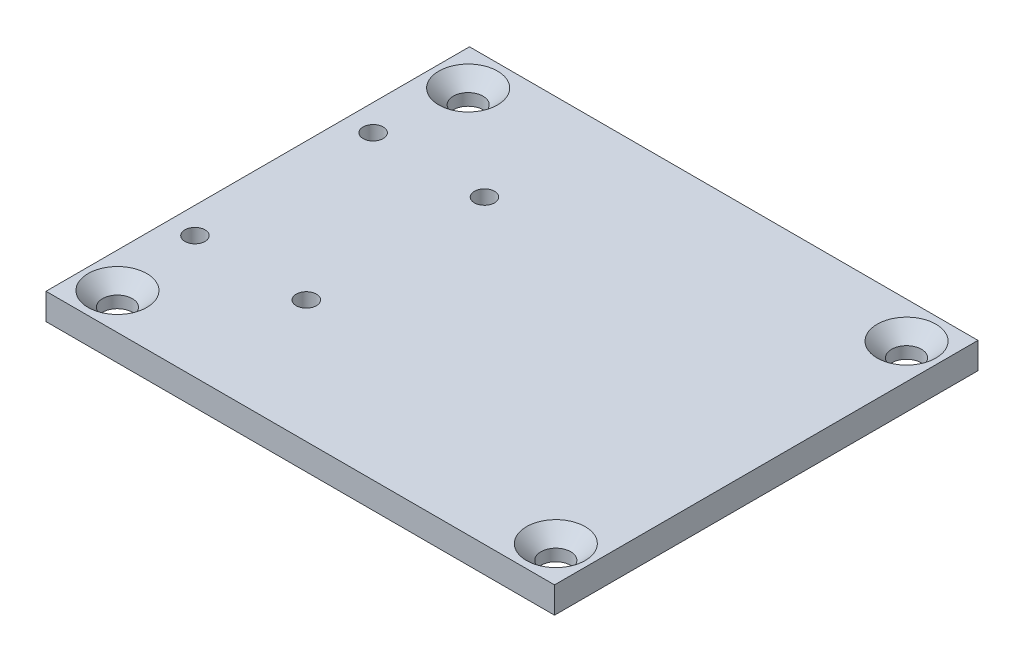
from build123d import *

# Parameters (mm, degrees)
SKETCH1_W                                      = 58
SKETCH1_H                                      = 48.3
BOSS_EXTRUDE1_DEPTH                            = 3
CSK_FOR_M3_FLAT_HEAD_MACHINE_SCREW1_AT_2_COUNT = 2
CSK_FOR_M3_FLAT_HEAD_MACHINE_SCREW1_AT_2_PITCH = 40
CSK_FOR_M3_FLAT_HEAD_MACHINE_SCREW1_AT_3_COUNT = 2
CSK_FOR_M3_FLAT_HEAD_MACHINE_SCREW1_AT_3_PITCH = 50
CSK_FOR_M3_FLAT_HEAD_MACHINE_SCREW1_AT_4_COUNT = 2
CSK_FOR_M3_FLAT_HEAD_MACHINE_SCREW1_AT_4_PITCH = 64.031242374
SKETCH6_R                                      = 1.15
CUT_EXTRUDE1_DEPTH                             = 10


with BuildPart() as part:
    # Sketch1 → Boss-Extrude1 (new body)
    with BuildSketch(Plane(origin=(0, 0, 0), x_dir=(1, 0, 0), z_dir=(0, 1, 0))):
        Rectangle(SKETCH1_W, SKETCH1_H)
    extrude(amount=BOSS_EXTRUDE1_DEPTH)

    # Sketch3 → CSK for M3 Flat Head Machine Screw1 (revolve, cut)
    with BuildSketch(Plane(origin=(25, 3, 20), x_dir=(0, 0, 1), z_dir=(1, 0, 0))):
        Polygon((0, 0), (0, 3), (1.7, 3), (1.7, 1.65), (3.35, 0), align=None)
    csk_for_m3_flat_head_machine_screw1 = revolve(axis=Axis((25, 9.35, 20), (0, -1, 0)), mode=Mode.SUBTRACT)

    # CSK for M3 Flat Head Machine Screw1 at 2: CSK for M3 Flat Head Machine Screw1 ×2
    with Locations(*[(0, 0, -i * CSK_FOR_M3_FLAT_HEAD_MACHINE_SCREW1_AT_2_PITCH) for i in range(1, CSK_FOR_M3_FLAT_HEAD_MACHINE_SCREW1_AT_2_COUNT)]):
        add(csk_for_m3_flat_head_machine_screw1, mode=Mode.SUBTRACT)

    # CSK for M3 Flat Head Machine Screw1 at 3: CSK for M3 Flat Head Machine Screw1 ×2
    with Locations(*[(-i * CSK_FOR_M3_FLAT_HEAD_MACHINE_SCREW1_AT_3_PITCH, 0, 0) for i in range(1, CSK_FOR_M3_FLAT_HEAD_MACHINE_SCREW1_AT_3_COUNT)]):
        add(csk_for_m3_flat_head_machine_screw1, mode=Mode.SUBTRACT)

    # CSK for M3 Flat Head Machine Screw1 at 4: CSK for M3 Flat Head Machine Screw1 ×2
    with Locations(*[Vector(-0.7808688094430304, 0, -0.6246950475544243) * (i * CSK_FOR_M3_FLAT_HEAD_MACHINE_SCREW1_AT_4_PITCH) for i in range(1, CSK_FOR_M3_FLAT_HEAD_MACHINE_SCREW1_AT_4_COUNT)]):
        add(csk_for_m3_flat_head_machine_screw1, mode=Mode.SUBTRACT)

    # Sketch6 → Cut-Extrude1 (cut)
    with BuildSketch(Plane(origin=(0, 3, 0), x_dir=(1, 0, 0), z_dir=(0, 1, 0))):
        with Locations(Location((-26, 10.16, 0), (0, 0, 270))):
            Circle(SKETCH6_R)
        with Locations(Location((-13.3, 10.16, 0), (0, 0, 270))):
            Circle(SKETCH6_R)
        with Locations(Location((-13.3, -10.16, 0), (0, 0, 270))):
            Circle(SKETCH6_R)
        with Locations(Location((-26, -10.16, 0), (0, 0, 270))):
            Circle(SKETCH6_R)
    extrude(amount=-CUT_EXTRUDE1_DEPTH, mode=Mode.SUBTRACT)


solid = part.part
